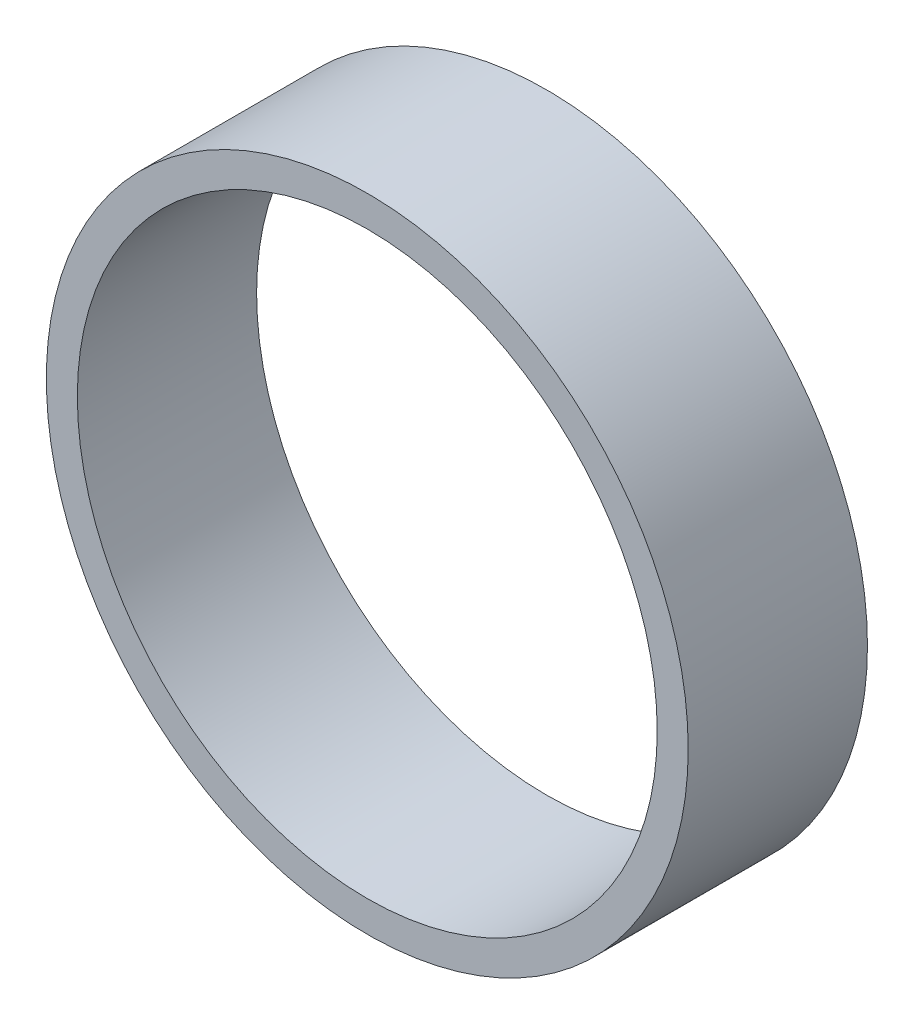
from build123d import *

# Parameters (mm, degrees)
SKETCH1_R           = 41
SKETCH1_R_2         = 37.040666473
BOSS_EXTRUDE1_DEPTH = 22.9


with BuildPart() as part:
    # Sketch1 → Boss-Extrude1 (new body)
    with BuildSketch(Plane(origin=(0, 0, 0), x_dir=(0, 1, 0), z_dir=(0, 0, 1))):
        with Locations(Location((0, 0, 0), (0, 0, 270))):
            Circle(SKETCH1_R)
        with Locations(Location((0, 0, 0), (0, 0, 270))):
            Circle(SKETCH1_R_2, mode=Mode.SUBTRACT)
    extrude(amount=BOSS_EXTRUDE1_DEPTH)


solid = part.part
